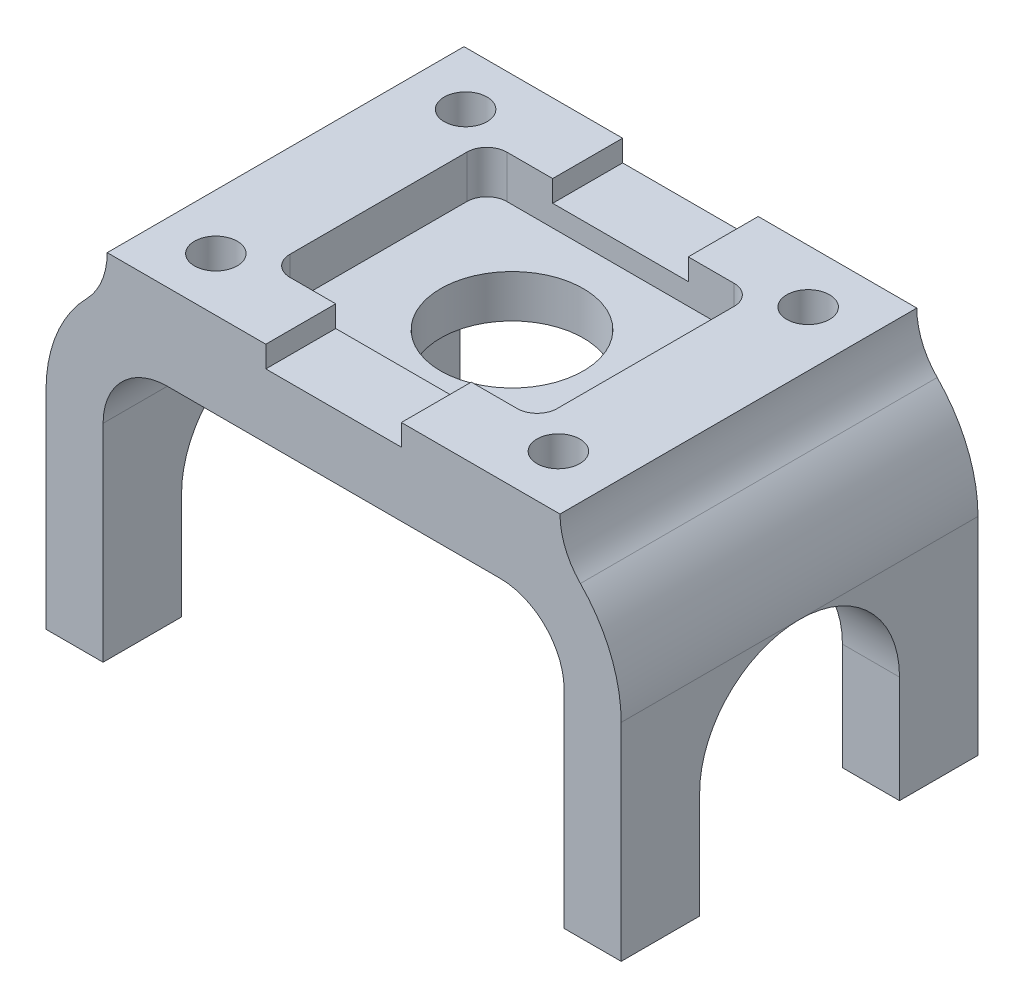
from build123d import *

# Parameters (mm, degrees)
BOSS_EXTRUDE1_DEPTH = 31.75
CUT_EXTRUDE1_DEPTH  = 118.537522281
CUT_EXTRUDE2_DEPTH  = 7.62
SKETCH5_W           = 24.13
SKETCH5_H           = 3.81
CUT_EXTRUDE3_DEPTH  = 95.766937067
CUT_EXTRUDE4_REACH  = 84.159
SKETCH6_R           = 12.7
CUT_EXTRUDE5_REACH  = 89.52
SKETCH7_R           = 3.81


with BuildPart() as part:
    # Sketch2 → Boss-Extrude1 (new, symmetric)
    with BuildSketch(Plane.XY):
        with BuildLine():
            Line((-29.591, 0), (29.591, 0))
            ThreePointArc((29.591, 0), (37.673230509, -3.347769491), (41.021, -11.43))
            Line((41.021, -11.43), (41.021, -48.26))
            Line((41.021, -48.26), (51.181, -48.26))
            Line((51.181, -48.26), (51.181, -11.43))
            ThreePointArc((51.181, -11.43), (49.29585059, -1.827302371), (43.920228208, 6.35))
            ThreePointArc((43.920228208, 6.35), (41.232417018, 10.438651186), (40.289842313, 15.24))
            Line((40.289842313, 15.24), (-40.289842313, 15.24))
            ThreePointArc((-40.289842313, 15.24), (-41.232417018, 10.438651186), (-43.920228208, 6.35))
            ThreePointArc((-43.920228208, 6.35), (-49.29585059, -1.827302371), (-51.181, -11.43))
            Line((-51.181, -11.43), (-51.181, -48.26))
            Line((-51.181, -48.26), (-41.021, -48.26))
            Line((-41.021, -48.26), (-41.021, -11.43))
            ThreePointArc((-41.021, -11.43), (-37.673230509, -3.347769491), (-29.591, 0))
        make_face()
    extrude(amount=BOSS_EXTRUDE1_DEPTH, both=True)

    # Sketch3 → Cut-Extrude1 (cut, through all)
    with BuildSketch(Plane(origin=(51.181, 0, 0), x_dir=(0, 0, -1), z_dir=(1, 0, 0))):
        with BuildLine():
            Line((-17.78, -48.26), (17.78, -48.26))
            Line((17.78, -48.26), (17.78, -29.21))
            ThreePointArc((17.78, -29.21), (0, -11.43), (-17.78, -29.21))
            Line((-17.78, -29.21), (-17.78, -48.26))
        make_face()
    extrude(amount=-CUT_EXTRUDE1_DEPTH, mode=Mode.SUBTRACT)

    # Sketch4 → Cut-Extrude2 (cut)
    with BuildSketch(Plane(origin=(0, 15.24, 0), x_dir=(1, 0, 0), z_dir=(0, 1, 0))):
        with BuildLine():
            Line((-20.223842313, 19.304), (20.223842313, 19.304))
            ThreePointArc((20.223842313, 19.304), (22.738314027, 18.262471714), (23.779842313, 15.748))
            Line((23.779842313, 15.748), (23.779842313, -15.748))
            ThreePointArc((23.779842313, -15.748), (22.738314027, -18.262471714), (20.223842313, -19.304))
            Line((20.223842313, -19.304), (-20.223842313, -19.304))
            ThreePointArc((-20.223842313, -19.304), (-22.738314027, -18.262471714), (-23.779842313, -15.748))
            Line((-23.779842313, -15.748), (-23.779842313, 15.748))
            ThreePointArc((-23.779842313, 15.748), (-22.738314027, 18.262471714), (-20.223842313, 19.304))
        make_face()
    extrude(amount=-CUT_EXTRUDE2_DEPTH, mode=Mode.SUBTRACT)

    # Sketch5 → Cut-Extrude3 (cut, through all)
    with BuildSketch(Plane.XY.offset(31.75)):
        with Locations((0, 13.335)):
            Rectangle(SKETCH5_W, SKETCH5_H)
    extrude(amount=-CUT_EXTRUDE3_DEPTH, mode=Mode.SUBTRACT)

    # Sketch6 → Cut-Extrude4 (cut, up to next)
    with BuildSketch(Plane(origin=(0, 7.62, 0), x_dir=(1, 0, 0), z_dir=(0, 1, 0)), mode=Mode.PRIVATE) as cut_extrude4_sk1:
        with Locations(Location((0, 0, 0), (0, 0, 270))):
            Circle(SKETCH6_R)
    cut_extrude4_tool1 = extrude(cut_extrude4_sk1.sketch, amount=-CUT_EXTRUDE4_REACH, mode=Mode.PRIVATE) & part.part
    add(cut_extrude4_tool1.solids().sort_by_distance((0, 7.62, 0))[0], mode=Mode.SUBTRACT)

    # Sketch7 → Cut-Extrude5 (cut, up to next)
    with BuildSketch(Plane(origin=(0, 15.24, 0), x_dir=(1, 0, 0), z_dir=(0, 1, 0)), mode=Mode.PRIVATE) as cut_extrude5_sk1:
        with Locations(Location((-30.48, 22.225, 0), (0, 0, 270))):
            Circle(SKETCH7_R)
    cut_extrude5_tool1 = extrude(cut_extrude5_sk1.sketch, amount=-CUT_EXTRUDE5_REACH, mode=Mode.PRIVATE) & part.part
    # Sketch7 → Cut-Extrude5 (cut, up to next)
    with BuildSketch(Plane(origin=(0, 15.24, 0), x_dir=(1, 0, 0), z_dir=(0, 1, 0)), mode=Mode.PRIVATE) as cut_extrude5_sk2:
        with Locations(Location((30.48, 22.225, 0), (0, 0, 270))):
            Circle(SKETCH7_R)
    cut_extrude5_tool2 = extrude(cut_extrude5_sk2.sketch, amount=-CUT_EXTRUDE5_REACH, mode=Mode.PRIVATE) & part.part
    # Sketch7 → Cut-Extrude5 (cut, up to next)
    with BuildSketch(Plane(origin=(0, 15.24, 0), x_dir=(1, 0, 0), z_dir=(0, 1, 0)), mode=Mode.PRIVATE) as cut_extrude5_sk3:
        with Locations(Location((30.48, -22.225, 0), (0, 0, 270))):
            Circle(SKETCH7_R)
    cut_extrude5_tool3 = extrude(cut_extrude5_sk3.sketch, amount=-CUT_EXTRUDE5_REACH, mode=Mode.PRIVATE) & part.part
    # Sketch7 → Cut-Extrude5 (cut, up to next)
    with BuildSketch(Plane(origin=(0, 15.24, 0), x_dir=(1, 0, 0), z_dir=(0, 1, 0)), mode=Mode.PRIVATE) as cut_extrude5_sk4:
        with Locations(Location((-30.48, -22.225, 0), (0, 0, 270))):
            Circle(SKETCH7_R)
    cut_extrude5_tool4 = extrude(cut_extrude5_sk4.sketch, amount=-CUT_EXTRUDE5_REACH, mode=Mode.PRIVATE) & part.part
    add(cut_extrude5_tool1.solids().sort_by_distance((-30.48, 15.24, -22.225))[0], mode=Mode.SUBTRACT)
    add(cut_extrude5_tool2.solids().sort_by_distance((30.48, 15.24, -22.225))[0], mode=Mode.SUBTRACT)
    add(cut_extrude5_tool3.solids().sort_by_distance((30.48, 15.24, 22.225))[0], mode=Mode.SUBTRACT)
    add(cut_extrude5_tool4.solids().sort_by_distance((-30.48, 15.24, 22.225))[0], mode=Mode.SUBTRACT)


solid = part.part
